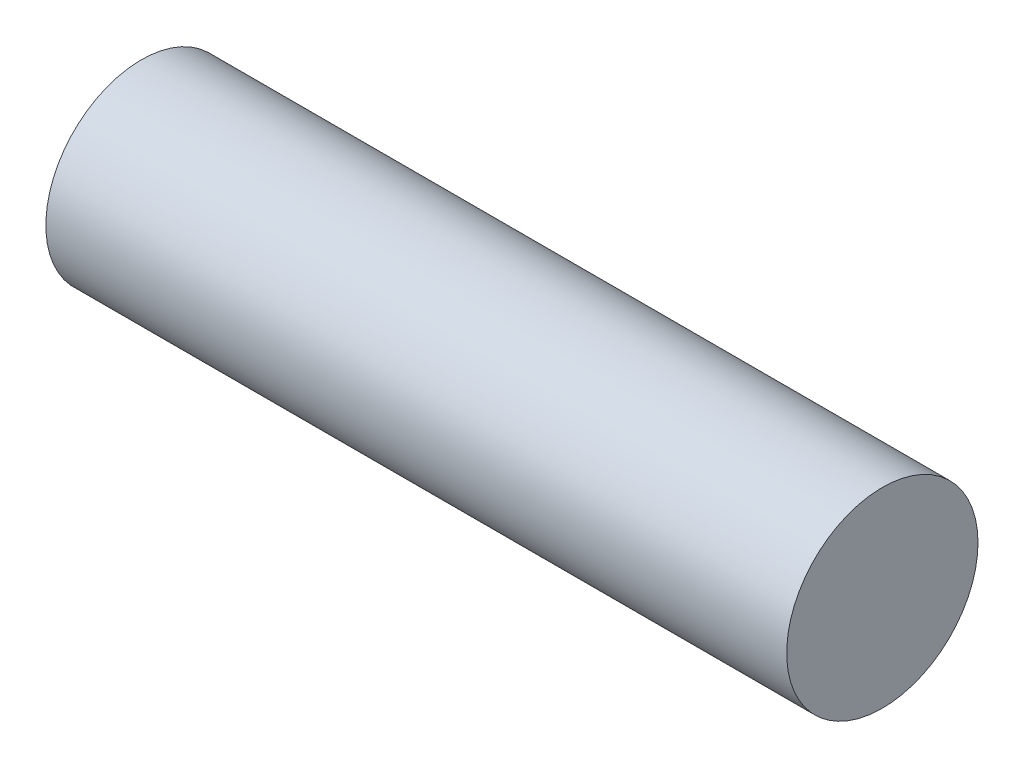
from build123d import *

# Parameters (mm, degrees)
SKETCH3_R           = 65.626931081
BOSS_EXTRUDE2_DEPTH = 508.254


with BuildPart() as part:
    # Sketch3 → Boss-Extrude2 (new body)
    with BuildSketch(Plane(origin=(0, 0, 0), x_dir=(0, 0, -1), z_dir=(1, 0, 0))):
        Circle(SKETCH3_R)
    extrude(amount=BOSS_EXTRUDE2_DEPTH)


solid = part.part
